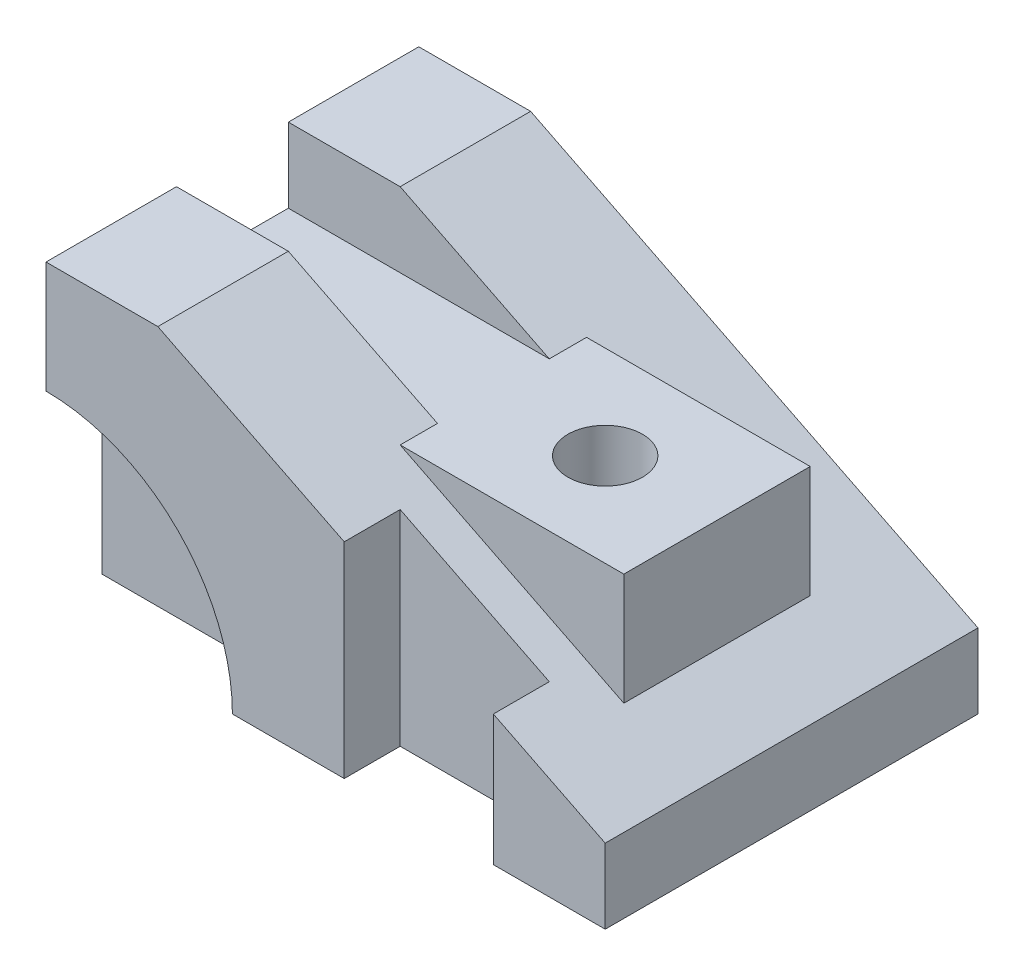
from build123d import *

# Parameters (mm, degrees)
BOSS_EXTRUDE1_DEPTH      = 50
BOSS_EXTRUDE1_DEPTH_BACK = 50
SKETCH3_R                = 50
CUT_EXTRUDE1_DEPTH       = 15
BOSS_EXTRUDE2_DEPTH      = 25
BOSS_EXTRUDE2_DEPTH_BACK = 25
SKETCH7_W                = 104.728565872
SKETCH7_H                = 30
CUT_EXTRUDE2_DEPTH       = 170.115345253
SKETCH8_R                = 10
CUT_EXTRUDE3_DEPTH       = 170.115345253
SKETCH9_W                = 40
SKETCH9_H                = 15
CUT_EXTRUDE4_DEPTH       = 178.200451467


with BuildPart() as part:
    # Sketch2 → Boss-Extrude1 (new, two sides: drawn at the far end of the back side and taken through both)
    with BuildSketch(Plane.XY.offset(-BOSS_EXTRUDE1_DEPTH_BACK)):
        Polygon((0, 0), (150, 0), (150, 20), (30, 80), (0, 80), align=None)
    extrude(amount=BOSS_EXTRUDE1_DEPTH + BOSS_EXTRUDE1_DEPTH_BACK)

    # Sketch3 → Cut-Extrude1 (cut)
    with BuildSketch(Plane.XY.offset(50)):
        Circle(SKETCH3_R)
    extrude(amount=-CUT_EXTRUDE1_DEPTH, mode=Mode.SUBTRACT)

    # Sketch6 → Boss-Extrude2 (add, two sides: drawn at the far end of the back side and taken through both)
    with BuildSketch(Plane.XY.offset(-BOSS_EXTRUDE2_DEPTH_BACK)):
        Polygon((70, 60), (130, 60), (130, 30), align=None)
    extrude(amount=BOSS_EXTRUDE2_DEPTH + BOSS_EXTRUDE2_DEPTH_BACK)

    # Sketch7 → Cut-Extrude2 (cut, through all)
    with BuildSketch(Plane(origin=(0, 60, 0), x_dir=(1, 0, 0), z_dir=(0, 1, 0))):
        with Locations((42.01672501, 0)):
            Rectangle(SKETCH7_W, SKETCH7_H)
    extrude(amount=CUT_EXTRUDE2_DEPTH, mode=Mode.SUBTRACT)

    # Sketch8 → Cut-Extrude3 (cut, through all)
    with BuildSketch(Plane(origin=(0, 60, 0), x_dir=(1, 0, 0), z_dir=(0, 1, 0))):
        with Locations((100, 0)):
            Circle(SKETCH8_R)
    extrude(amount=-CUT_EXTRUDE3_DEPTH, mode=Mode.SUBTRACT)

    # Sketch9 → Cut-Extrude4 (cut, through all)
    with BuildSketch(Plane.XZ):
        with Locations((100, 42.5)):
            Rectangle(SKETCH9_W, SKETCH9_H)
    extrude(amount=-CUT_EXTRUDE4_DEPTH, mode=Mode.SUBTRACT)


solid = part.part
